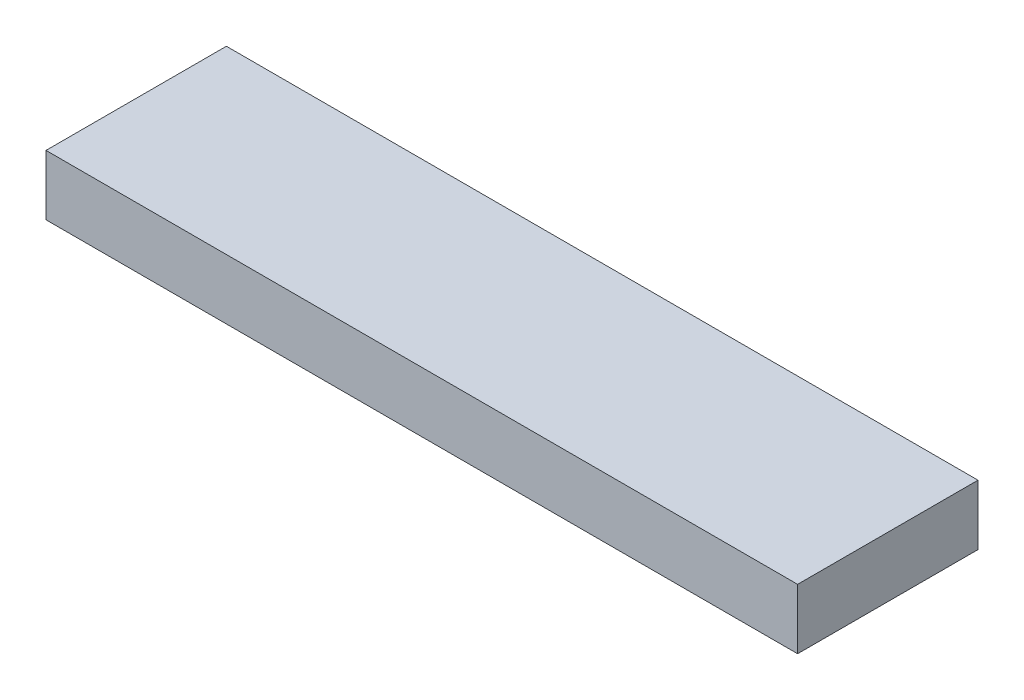
from build123d import *

# Parameters (mm, degrees)
SKETCH1_W           = 50
SKETCH1_H           = 12
BOSS_EXTRUDE1_DEPTH = 4


with BuildPart() as part:
    # Sketch1 → Boss-Extrude1 (new body)
    with BuildSketch(Plane(origin=(0, 0, 0), x_dir=(1, 0, 0), z_dir=(0, 1, 0))):
        with Locations((25, 6)):
            Rectangle(SKETCH1_W, SKETCH1_H)
    extrude(amount=BOSS_EXTRUDE1_DEPTH)


solid = part.part
